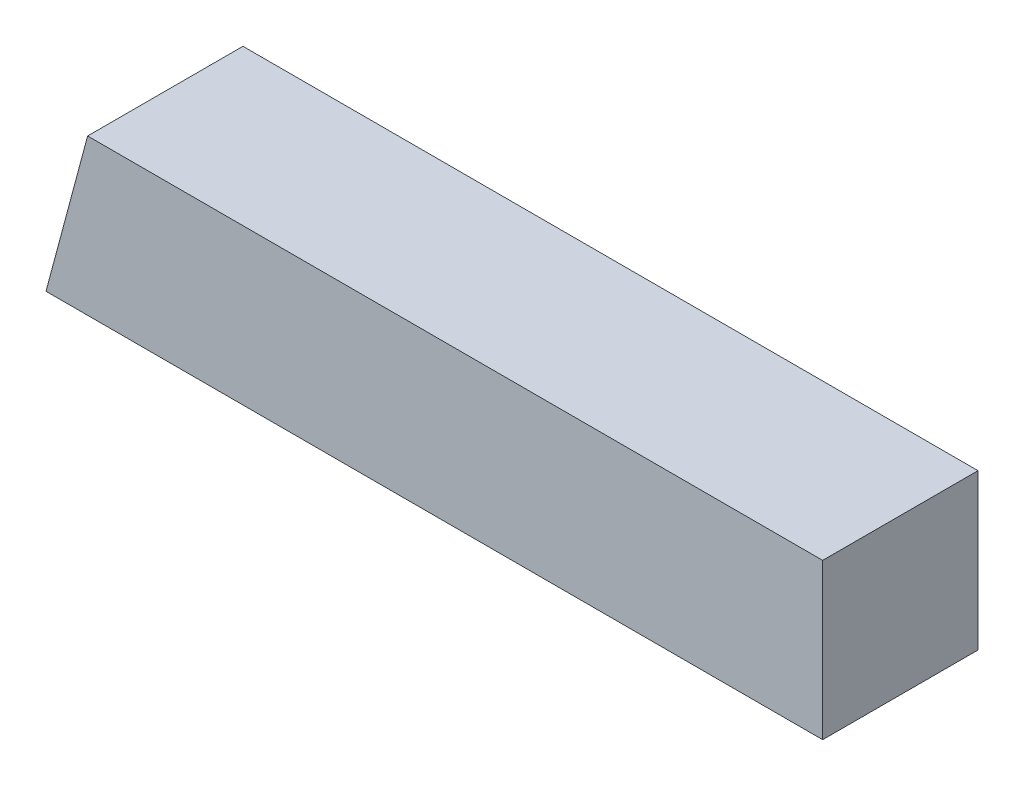
from build123d import *

# Parameters (mm, degrees)
BOSS_EXTRU_1_DEPTH = 30


with BuildPart() as part:
    # Esquisse1 → Boss.-Extru.1 (new body)
    with BuildSketch(Plane.XY):
        Polygon((-43.344377666, -15.229752461), (-35.305901894, 14.770247539), (106.655622334, 14.770247539), (106.655622334, -15.229752461), align=None)
    extrude(amount=BOSS_EXTRU_1_DEPTH)


solid = part.part
